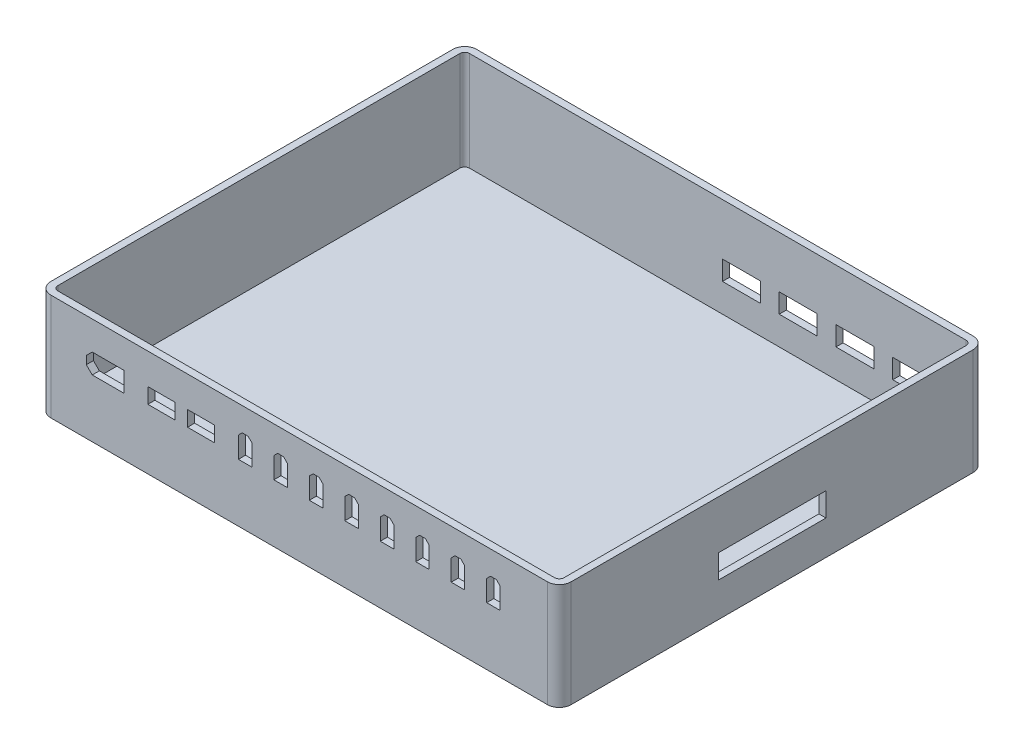
from build123d import *

# Parameters (mm, degrees)
SKETCH1_W           = 220
SKETCH1_H           = 180
BOSS_EXTRUDE1_DEPTH = 45
FILLET1_R           = 5
SHELL1_T            = -3
CUT_EXTRUDE2_DEPTH  = 5
CUT_EXTRUDE3_DEPTH  = 5
SKETCH4_W           = 11.5
SKETCH4_H           = 6.5
CUT_EXTRUDE4_DEPTH  = 5
SKETCH5_W           = 45.536818034
SKETCH5_H           = 10
CUT_EXTRUDE5_DEPTH  = 5
SKETCH6_W           = 16
SKETCH6_H           = 8.2
CUT_EXTRUDE6_DEPTH  = 5


with BuildPart() as part:
    # Sketch1 → Boss-Extrude1 (new body)
    with BuildSketch(Plane(origin=(0, 0, 0), x_dir=(1, 0, 0), z_dir=(0, 1, 0))):
        with Locations((110, 90)):
            Rectangle(SKETCH1_W, SKETCH1_H)
    extrude(amount=BOSS_EXTRUDE1_DEPTH)

    # Fillet1
    fillet1_edges = [part.edges().sort_by_distance(p)[0] for p in [
        (0, 22.5, -180),
        (220, 22.5, -180),
        (220, 22.5, 0),
        (0, 22.5, 0),
    ]]
    fillet(fillet1_edges, radius=FILLET1_R)

    # Shell1
    shell1_openings = [part.faces().sort_by_distance(p)[0] for p in [
        (110, 45, -90),
    ]]
    offset(amount=SHELL1_T, openings=shell1_openings, kind=Kind.INTERSECTION)

    # Sketch2 → Cut-Extrude2 (cut)
    with BuildSketch(Plane.XY):
        Polygon((175.9, 35), (178.4, 35), (180, 33.4), (180, 24.5), (174.3, 24.5), (174.3, 33.4), align=None)
        Polygon((190.9, 35), (193.4, 35), (195, 33.4), (195, 24.5), (189.3, 24.5), (189.3, 33.4), align=None)
        Polygon((160.9, 35), (163.4, 35), (165, 33.4), (165, 24.5), (159.3, 24.5), (159.3, 33.4), align=None)
        Polygon((145.9, 35), (148.4, 35), (150, 33.4), (150, 24.5), (144.3, 24.5), (144.3, 33.4), align=None)
        Polygon((130.9, 35), (133.4, 35), (135, 33.4), (135, 24.5), (129.3, 24.5), (129.3, 33.4), align=None)
        Polygon((115.9, 35), (118.4, 35), (120, 33.4), (120, 24.5), (114.3, 24.5), (114.3, 33.4), align=None)
        Polygon((100.9, 35), (103.4, 35), (105, 33.4), (105, 24.5), (99.3, 24.5), (99.3, 33.4), align=None)
        Polygon((85.9, 35), (88.4, 35), (90, 33.4), (90, 24.5), (84.3, 24.5), (84.3, 33.4), align=None)
    extrude(amount=-CUT_EXTRUDE2_DEPTH, mode=Mode.SUBTRACT)

    # Sketch3 → Cut-Extrude3 (cut)
    with BuildSketch(Plane.XY):
        Polygon((22.5, 32.9), (36, 32.9), (36, 24.5), (22.5, 24.5), (20, 27), (20, 30.4), align=None)
    extrude(amount=-CUT_EXTRUDE3_DEPTH, mode=Mode.SUBTRACT)

    # Sketch4 → Cut-Extrude4 (cut)
    with BuildSketch(Plane.XY):
        with Locations((51.75, 28.75)):
            Rectangle(SKETCH4_W, SKETCH4_H)
        with Locations((68.55, 28.75)):
            Rectangle(SKETCH4_W, SKETCH4_H)
    extrude(amount=-CUT_EXTRUDE4_DEPTH, mode=Mode.SUBTRACT)

    # Sketch5 → Cut-Extrude5 (cut)
    with BuildSketch(Plane(origin=(220, 0, 0), x_dir=(0, 0, -1), z_dir=(1, 0, 0))):
        with Locations((90, 19.480228536)):
            Rectangle(SKETCH5_W, SKETCH5_H)
    extrude(amount=-CUT_EXTRUDE5_DEPTH, mode=Mode.SUBTRACT)

    # Sketch6 → Cut-Extrude6 (cut)
    with BuildSketch(Plane(origin=(0, 0, -180), x_dir=(-1, 0, 0), z_dir=(0, 0, -1))):
        with Locations((-192, 19.1)):
            Rectangle(SKETCH6_W, SKETCH6_H)
        with Locations((-168, 19.1)):
            Rectangle(SKETCH6_W, SKETCH6_H)
        with Locations((-144, 19.1)):
            Rectangle(SKETCH6_W, SKETCH6_H)
        with Locations((-120, 19.1)):
            Rectangle(SKETCH6_W, SKETCH6_H)
    extrude(amount=-CUT_EXTRUDE6_DEPTH, mode=Mode.SUBTRACT)


solid = part.part
